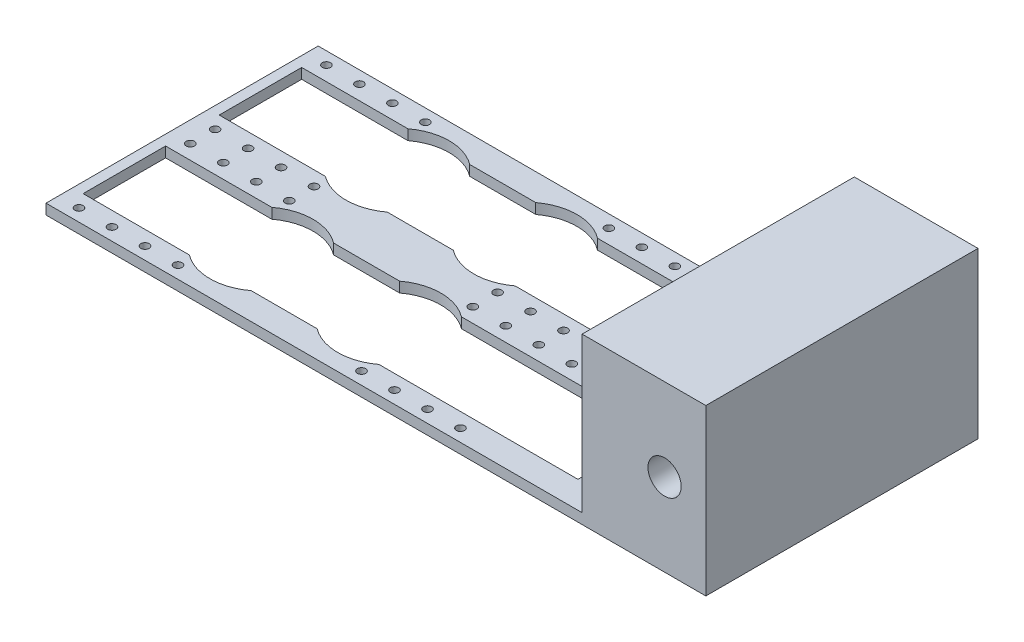
from build123d import *

# Parameters (mm, degrees)
SKETCH1_W           = 160
SKETCH1_H           = 66
BOSS_EXTRUDE1_DEPTH = 40
SKETCH2_R           = 4.025
SKETCH2_W           = 130
SKETCH2_H           = 37.5
CUT_EXTRUDE1_DEPTH  = 112.157545853
SKETCH3_R           = 1
SKETCH3_W           = 120
SKETCH3_H           = 20
CUT_EXTRUDE2_DEPTH  = 96.336247042
SKETCH4_R           = 12.5
CUT_EXTRUDE3_DEPTH  = 95.314633011


with BuildPart() as part:
    # Sketch1 → Boss-Extrude1 (new body)
    with BuildSketch(Plane(origin=(0, 0, 0), x_dir=(1, 0, 0), z_dir=(0, 1, 0))):
        Rectangle(SKETCH1_W, SKETCH1_H)
    extrude(amount=BOSS_EXTRUDE1_DEPTH)

    # Sketch2 → Cut-Extrude1 (cut, through all)
    with BuildSketch(Plane.XY.offset(33)):
        with Locations((70, 20)):
            Circle(SKETCH2_R)
        with Locations((-15, 21.25)):
            Rectangle(SKETCH2_W, SKETCH2_H)
    extrude(amount=-CUT_EXTRUDE1_DEPTH, mode=Mode.SUBTRACT)

    # Sketch3 → Cut-Extrude2 (cut, through all)
    with BuildSketch(Plane(origin=(0, 40, 0), x_dir=(1, 0, 0), z_dir=(0, 1, 0))):
        with Locations(Location((-75, 30, 0), (0, 0, 270))):
            Circle(SKETCH3_R)
        with Locations(Location((-75, 3, 0), (0, 0, 270))):
            Circle(SKETCH3_R)
        with Locations(Location((-67, 30, 0), (0, 0, 270))):
            Circle(SKETCH3_R)
        with Locations(Location((-59, 30, 0), (0, 0, 270))):
            Circle(SKETCH3_R)
        with Locations(Location((-51, 30, 0), (0, 0, 270))):
            Circle(SKETCH3_R)
        with Locations(Location((-67, 3, 0), (0, 0, 270))):
            Circle(SKETCH3_R)
        with Locations(Location((-59, 3, 0), (0, 0, 270))):
            Circle(SKETCH3_R)
        with Locations(Location((-51, 3, 0), (0, 0, 270))):
            Circle(SKETCH3_R)
        with Locations(Location((-6.5, 30, 0), (0, 0, 270))):
            Circle(SKETCH3_R)
        with Locations(Location((-6.5, 3, 0), (0, 0, 270))):
            Circle(SKETCH3_R)
        with Locations(Location((1.5, 30, 0), (0, 0, 270))):
            Circle(SKETCH3_R)
        with Locations(Location((9.5, 30, 0), (0, 0, 270))):
            Circle(SKETCH3_R)
        with Locations(Location((17.5, 30, 0), (0, 0, 270))):
            Circle(SKETCH3_R)
        with Locations(Location((1.5, 3, 0), (0, 0, 270))):
            Circle(SKETCH3_R)
        with Locations(Location((9.5, 3, 0), (0, 0, 270))):
            Circle(SKETCH3_R)
        with Locations(Location((17.5, 3, 0), (0, 0, 270))):
            Circle(SKETCH3_R)
        with Locations((17.5, -3)):
            Circle(SKETCH3_R)
        with Locations((9.5, -3)):
            Circle(SKETCH3_R)
        with Locations((1.5, -3)):
            Circle(SKETCH3_R)
        with Locations((17.5, -30)):
            Circle(SKETCH3_R)
        with Locations((9.5, -30)):
            Circle(SKETCH3_R)
        with Locations((1.5, -30)):
            Circle(SKETCH3_R)
        with Locations((-6.5, -3)):
            Circle(SKETCH3_R)
        with Locations((-6.5, -30)):
            Circle(SKETCH3_R)
        with Locations((-51, -3)):
            Circle(SKETCH3_R)
        with Locations((-59, -3)):
            Circle(SKETCH3_R)
        with Locations((-67, -3)):
            Circle(SKETCH3_R)
        with Locations((-51, -30)):
            Circle(SKETCH3_R)
        with Locations((-59, -30)):
            Circle(SKETCH3_R)
        with Locations((-67, -30)):
            Circle(SKETCH3_R)
        with Locations((-75, -3)):
            Circle(SKETCH3_R)
        with Locations((-75, -30)):
            Circle(SKETCH3_R)
        with Locations((-17.5, 16.5)):
            Rectangle(SKETCH3_W, SKETCH3_H)
        with Locations((-17.5, -16.5)):
            Rectangle(SKETCH3_W, SKETCH3_H)
    extrude(amount=-CUT_EXTRUDE2_DEPTH, mode=Mode.SUBTRACT)

    # Sketch4 → Cut-Extrude3 (cut, through all)
    with BuildSketch(Plane(origin=(0, 2.5, 0), x_dir=(1, 0, 0), z_dir=(0, 1, 0))):
        with Locations((-44.25, -16.5)):
            Circle(SKETCH4_R)
        with Locations((-44.25, 16.5)):
            Circle(SKETCH4_R)
        with Locations((-13.25, 16.5)):
            Circle(SKETCH4_R)
        with Locations((-13.25, -16.5)):
            Circle(SKETCH4_R)
    extrude(amount=-CUT_EXTRUDE3_DEPTH, mode=Mode.SUBTRACT)


solid = part.part
